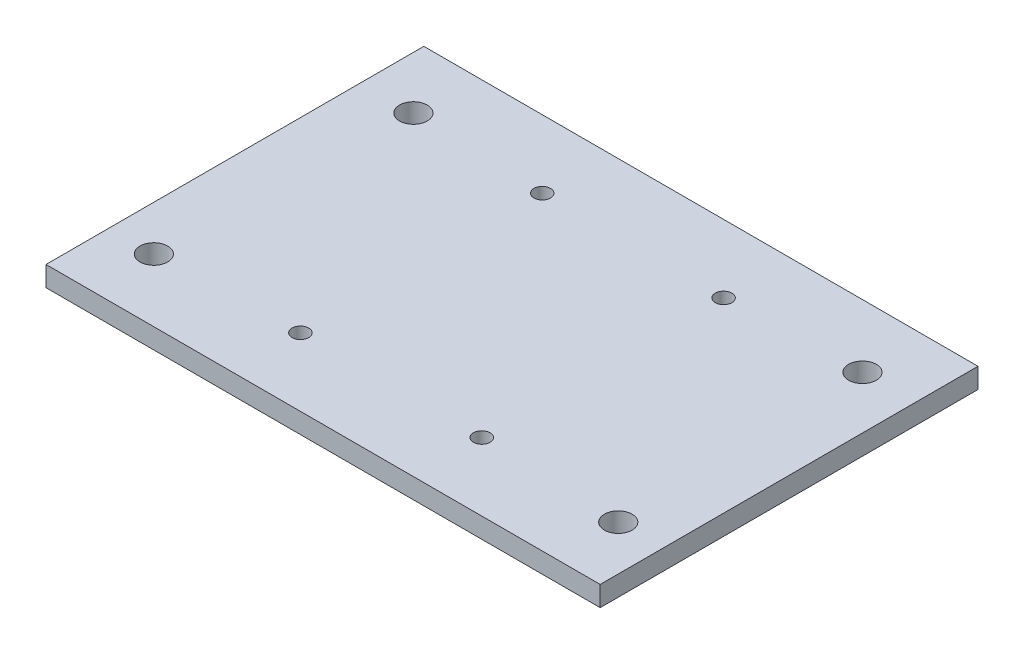
from build123d import *

# Parameters (mm, degrees)
SKETCH_1_W      = 110
SKETCH_1_H      = 75
SKETCH_1_R      = 1.65
SKETCH_1_R_2    = 2.75
EXTRUDE_1_DEPTH = 4


with BuildPart() as part:
    # 草圖1 → 填料-伸長1 (new body)
    with BuildSketch(Plane(origin=(0, 0, 0), x_dir=(1, 0, 0), z_dir=(0, 1, 0))):
        Rectangle(SKETCH_1_W, SKETCH_1_H)
        with Locations(Location((-18, 24, 0), (0, 0, 270))):
            Circle(SKETCH_1_R, mode=Mode.SUBTRACT)
        with Locations(Location((18, 24, 0), (0, 0, 270))):
            Circle(SKETCH_1_R, mode=Mode.SUBTRACT)
        with Locations(Location((-18, -24, 0), (0, 0, 270))):
            Circle(SKETCH_1_R, mode=Mode.SUBTRACT)
        with Locations(Location((18, -24, 0), (0, 0, 270))):
            Circle(SKETCH_1_R, mode=Mode.SUBTRACT)
        with Locations(Location((-44.57, 25, 0), (0, 0, 270))):
            Circle(SKETCH_1_R_2, mode=Mode.SUBTRACT)
        with Locations(Location((-46.095, -25, 0), (0, 0, 270))):
            Circle(SKETCH_1_R_2, mode=Mode.SUBTRACT)
        with Locations(Location((44.57, 25, 0), (0, 0, 270))):
            Circle(SKETCH_1_R_2, mode=Mode.SUBTRACT)
        with Locations(Location((46.095, -25, 0), (0, 0, 270))):
            Circle(SKETCH_1_R_2, mode=Mode.SUBTRACT)
    extrude(amount=EXTRUDE_1_DEPTH)


solid = part.part
